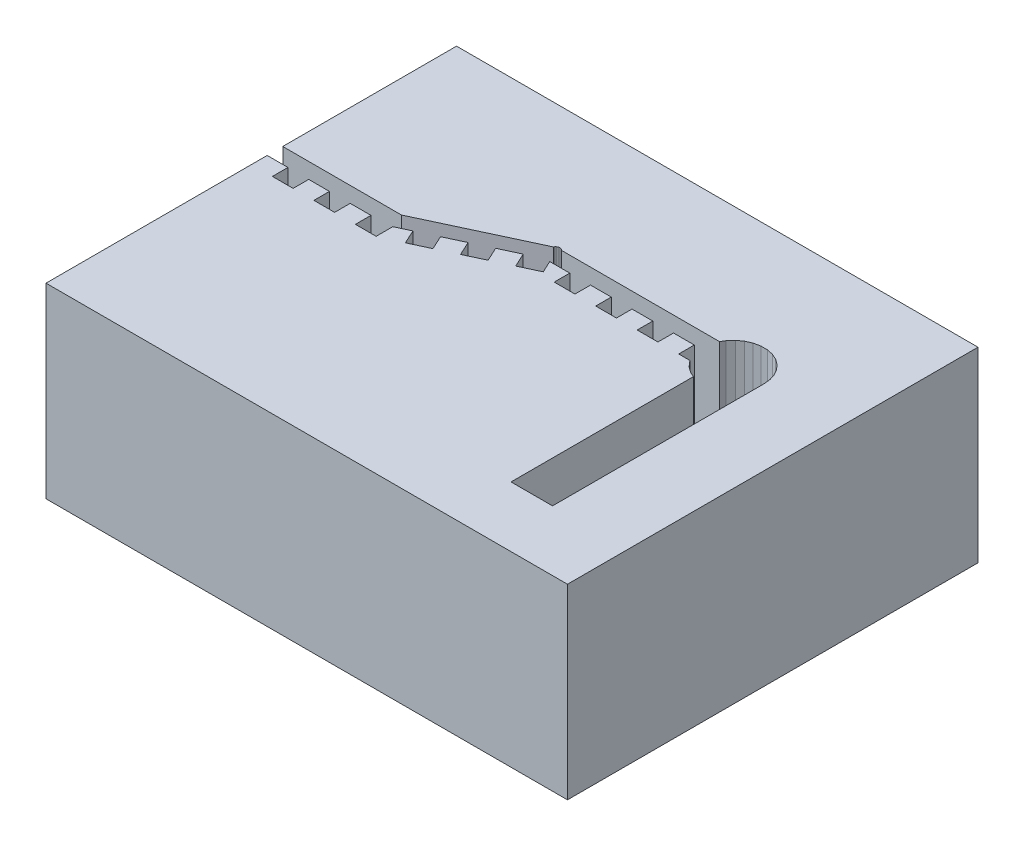
from build123d import *

# Parameters (mm, degrees)
BOSS_EXTRUDE1_DEPTH = 7
SKETCH2_W           = 25.128147065
SKETCH2_H           = 19.783027292
BOSS_EXTRUDE2_DEPTH = 2


with BuildPart() as part:
    # Sketch1 → Boss-Extrude1 (new body)
    with BuildSketch(Plane(origin=(0, 0, 0), x_dir=(1, 0, 0), z_dir=(0, 1, 0))):
        Polygon((19.500000402, -8.500000462), (21.50000073, -8.500000462), (21.50000073, 1.499999315), (21.50000073, 1.699998975), (21.467199549, 2.011898905), (21.370301023, 2.31009908), (21.213499829, 2.58169882), (21.003700793, 2.814698964), (20.750001073, 2.998998389), (20.463500172, 3.126598895), (20.156800747, 3.191798925), (19.843200222, 3.191798925), (19.536500797, 3.126598895), (19.249999896, 2.998998389), (18.996300176, 2.814698964), (18.786501139, 2.58169882), (18.670000136, 2.379998565), (11.050600559, 2.379998565), (11.033799499, 2.398598939), (10.99999994, 2.423198894), (10.961800814, 2.440199256), (10.920900851, 2.448899671), (10.879099369, 2.448899671), (10.838199407, 2.440199256), (10.80000028, 2.423198894), (10.766200721, 2.398598939), (10.738201439, 2.367598936), (10.717000812, 2.33049877), (5.719300359, 0), (0, 0), (0, 8.374300694), (25.128147065, 8.374300694), (25.128147065, -11.408726598), (0, -11.408726598), (0, -0.75000152), (1.000002027, -0.75000152), (1.000002027, -1.500001177), (2.000000328, -1.500001177), (2.000000328, -0.75000152), (2.999998629, -0.75000152), (2.999998629, -1.500001177), (4.000000656, -1.500001177), (4.000000656, -0.75000152), (4.999998957, -0.75000152), (4.999998957, -1.500001177), (6.000000983, -1.500001177), (6.000000983, -0.696601346), (6.660599262, -0.388601795), (6.977502257, -1.068301499), (7.883802056, -0.645700842), (7.566899061, 0.033998862), (8.473198861, 0.456599519), (8.790101856, -0.223100185), (9.696502239, 0.199498609), (9.379498661, 0.879198313), (10.285802186, 1.301899552), (10.602802038, 0.622099265), (11.155799031, 0.87999925), (11.199999601, 0.900598243), (11.509099975, 1.044699922), (11.236201972, 1.629998907), (12.199999765, 1.629998907), (12.199999765, 0.87999925), (13.199999928, 0.87999925), (13.199999928, 1.629998907), (14.200000092, 1.629998907), (14.200000092, 0.87999925), (15.200000256, 0.87999925), (15.200000256, 1.629998907), (16.20000042, 1.629998907), (16.20000042, 0.87999925), (17.200000584, 0.87999925), (17.200000584, 1.629998907), (18.200000748, 1.629998907), (18.200000748, 0.87999925), (18.750900403, 0.87999925), (18.786501139, 0.81829913), (18.996300176, 0.585298985), (19.249999896, 0.400999561), (19.500000402, 0.289699063), align=None)
    extrude(amount=BOSS_EXTRUDE1_DEPTH)

    # Sketch2 → Boss-Extrude2 (add)
    with BuildSketch(Plane.XZ):
        with Locations((12.564073533, 1.517212952)):
            Rectangle(SKETCH2_W, SKETCH2_H)
    extrude(amount=BOSS_EXTRUDE2_DEPTH)


solid = part.part
